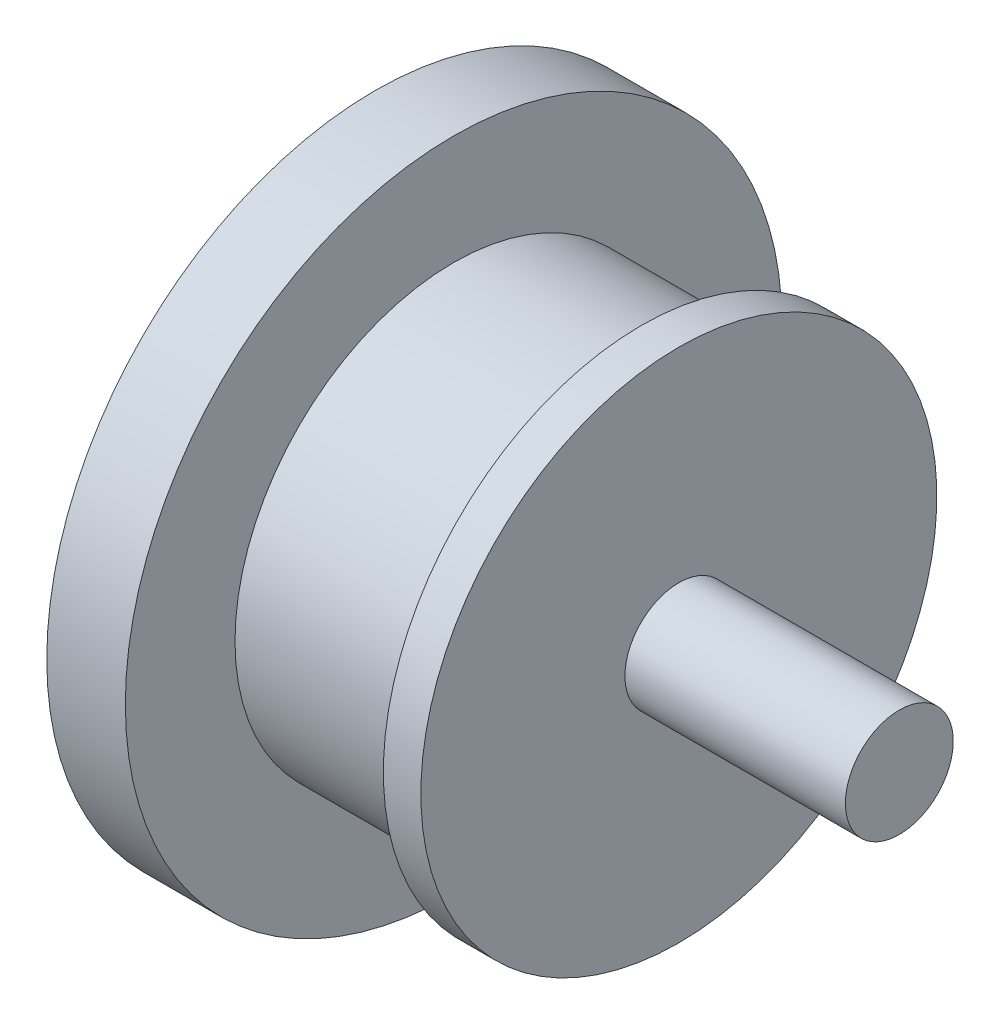
from build123d import *


with BuildPart() as part:
    # Sketch1 → Revolve1 (revolve)
    with BuildSketch(Plane.XY):
        Polygon((-7.35, 14), (-4, 14), (-4, 9.325), (4, 9.325), (4, 11), (5.6, 11), (5.6, 2.3), (15, 2.3), (15, 0), (5.6, 0), (-7.35, 0), align=None)
    revolve(axis=Axis((0, 0, 0), (-1, 0, 0)))


solid = part.part
